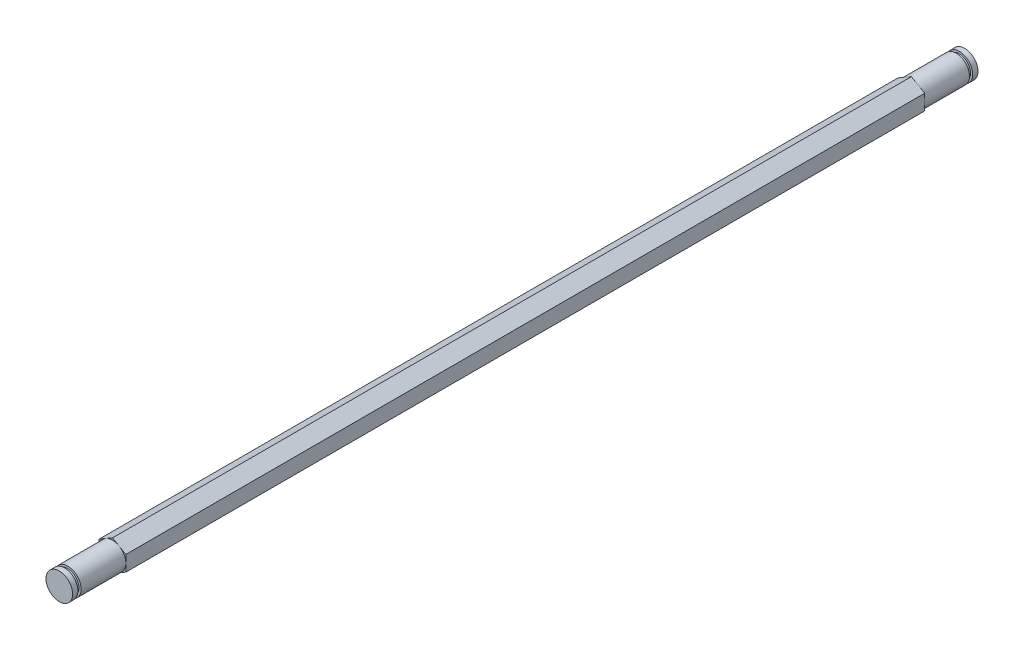
from build123d import *

# Parameters (mm, degrees)
BOSS_EXTRUDE2_DEPTH = 215.9
SKETCH5_OUTSIDE_W   = 51.574
SKETCH5_OUTSIDE_H   = 52.556
SKETCH5_OUTSIDE_R   = 3.175
CUT_EXTRUDE1_DEPTH  = 12.7
SKETCH6_OUTSIDE_W   = 51.574
SKETCH6_OUTSIDE_H   = 52.556
SKETCH6_OUTSIDE_R   = 3.175
CUT_EXTRUDE2_DEPTH  = 12.7
SKETCH7_OUTSIDE_W   = 51.574
SKETCH7_OUTSIDE_H   = 52.556
SKETCH7_OUTSIDE_R   = 2.667
CUT_EXTRUDE3_DEPTH  = 0.762
SKETCH9_OUTSIDE_W   = 51.574
SKETCH9_OUTSIDE_H   = 52.556
SKETCH9_OUTSIDE_R   = 2.667
CUT_EXTRUDE4_DEPTH  = 0.762


with BuildPart() as part:
    # Sketch3 → Boss-Extrude2 (new body)
    with BuildSketch(Plane.XY):
        Polygon((0, 3.666174209), (-3.175, 1.833087105), (-3.175, -1.833087105), (0, -3.666174209), (3.175, -1.833087105), (3.175, 1.833087105), align=None)
    extrude(amount=BOSS_EXTRUDE2_DEPTH)

    # Sketch5 outside → Cut-Extrude1 (cut)
    with BuildSketch(Plane(origin=(0, 0, 0), x_dir=(-1, 0, 0), z_dir=(0, 0, -1))):
        Rectangle(SKETCH5_OUTSIDE_W, SKETCH5_OUTSIDE_H)
        with Locations(Location((0, 0, 0), (0, 0, 180))):
            Circle(SKETCH5_OUTSIDE_R, mode=Mode.SUBTRACT)
    extrude(amount=-CUT_EXTRUDE1_DEPTH, mode=Mode.SUBTRACT)

    # Sketch6 outside → Cut-Extrude2 (cut)
    with BuildSketch(Plane.XY.offset(215.9)):
        Rectangle(SKETCH6_OUTSIDE_W, SKETCH6_OUTSIDE_H)
        Circle(SKETCH6_OUTSIDE_R, mode=Mode.SUBTRACT)
    extrude(amount=-CUT_EXTRUDE2_DEPTH, mode=Mode.SUBTRACT)

    # Sketch7 outside → Cut-Extrude3 (cut)
    with BuildSketch(Plane.XY.offset(214.63)):
        Rectangle(SKETCH7_OUTSIDE_W, SKETCH7_OUTSIDE_H)
        Circle(SKETCH7_OUTSIDE_R, mode=Mode.SUBTRACT)
    extrude(amount=-CUT_EXTRUDE3_DEPTH, mode=Mode.SUBTRACT)

    # Sketch9 outside → Cut-Extrude4 (cut)
    with BuildSketch(Plane(origin=(0, 0, 1.27), x_dir=(-1, 0, 0), z_dir=(0, 0, -1))):
        Rectangle(SKETCH9_OUTSIDE_W, SKETCH9_OUTSIDE_H)
        with Locations(Location((0, 0, 0), (0, 0, 180))):
            Circle(SKETCH9_OUTSIDE_R, mode=Mode.SUBTRACT)
    extrude(amount=-CUT_EXTRUDE4_DEPTH, mode=Mode.SUBTRACT)


solid = part.part
